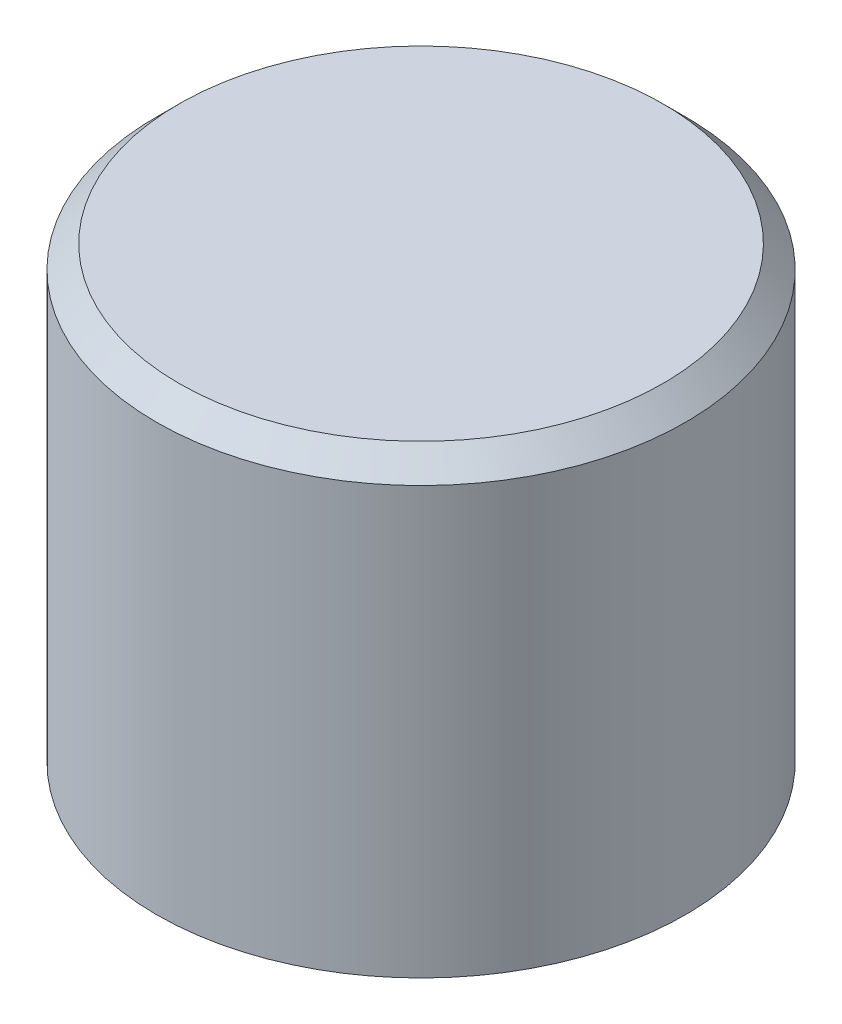
from build123d import *

# Parameters (mm, degrees)
SKIZZE1_R                       = 8.25
AUFSATZ_LINEAR_AUSTRAGEN1_DEPTH = 14
FASE1_SIZE                      = 0.7


with BuildPart() as part:
    # Skizze1 → Aufsatz-Linear austragen1 (new body)
    with BuildSketch(Plane(origin=(0, 0, 0), x_dir=(1, 0, 0), z_dir=(0, 1, 0))):
        Circle(SKIZZE1_R)
    extrude(amount=AUFSATZ_LINEAR_AUSTRAGEN1_DEPTH)

    # Fase1
    fase1_edges = [part.edges().sort_by_distance(p)[0] for p in [
        (-8.25, 14, 0),
    ]]
    chamfer(fase1_edges, length=FASE1_SIZE)


solid = part.part
